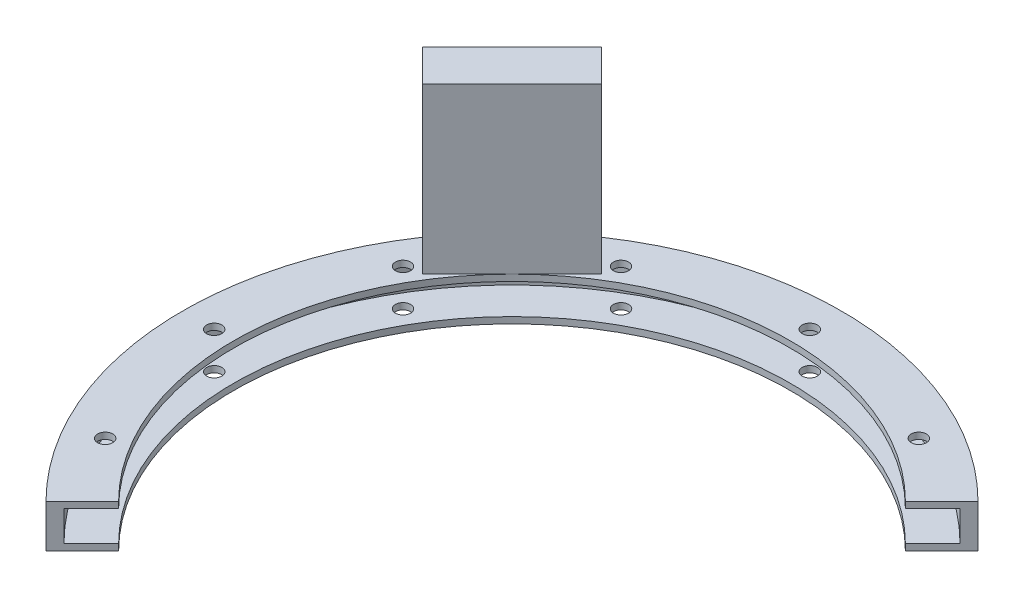
from build123d import *

# Parameters (mm, degrees)
SKETCH1_R           = 260
SKETCH1_R_2         = 6
SKETCH1_R_3         = 219.5
BOSS_EXTRUDE1_DEPTH = 17
SKETCH2_R           = 250
CUT_EXTRUDE1_DEPTH  = 12
CUT_EXTRUDE2_DEPTH  = 370.264133108
BOSS_EXTRUDE2_DEPTH = 130


with BuildPart() as part:
    # Sketch1 → Boss-Extrude1 (new, symmetric)
    with BuildSketch(Plane(origin=(0, 0, 0), x_dir=(1, 0, 0), z_dir=(0, 1, 0))):
        with Locations(Location((0, 0, 0), (0, 0, 270))):
            Circle(SKETCH1_R)
        with Locations(Location((-117.5, 203.515969889, 0), (0, 0, 270))):
            Circle(SKETCH1_R_2, mode=Mode.SUBTRACT)
        with Locations(Location((-203.515969889, 117.5, 0), (0, 0, 270))):
            Circle(SKETCH1_R_2, mode=Mode.SUBTRACT)
        with Locations(Location((-235, 0, 0), (0, 0, 270))):
            Circle(SKETCH1_R_2, mode=Mode.SUBTRACT)
        with Locations(Location((-203.515969889, -117.5, 0), (0, 0, 270))):
            Circle(SKETCH1_R_2, mode=Mode.SUBTRACT)
        with Locations(Location((-117.5, -203.515969889, 0), (0, 0, 270))):
            Circle(SKETCH1_R_2, mode=Mode.SUBTRACT)
        with Locations(Location((0, -235, 0), (0, 0, 270))):
            Circle(SKETCH1_R_2, mode=Mode.SUBTRACT)
        with Locations(Location((117.5, -203.515969889, 0), (0, 0, 270))):
            Circle(SKETCH1_R_2, mode=Mode.SUBTRACT)
        with Locations(Location((203.515969889, -117.5, 0), (0, 0, 270))):
            Circle(SKETCH1_R_2, mode=Mode.SUBTRACT)
        with Locations(Location((235, 0, 0), (0, 0, 270))):
            Circle(SKETCH1_R_2, mode=Mode.SUBTRACT)
        with Locations(Location((203.515969889, 117.5, 0), (0, 0, 270))):
            Circle(SKETCH1_R_2, mode=Mode.SUBTRACT)
        with Locations(Location((117.5, 203.515969889, 0), (0, 0, 270))):
            Circle(SKETCH1_R_2, mode=Mode.SUBTRACT)
        with Locations(Location((0, 235, 0), (0, 0, 270))):
            Circle(SKETCH1_R_2, mode=Mode.SUBTRACT)
        with Locations(Location((0, 0, 0), (0, 0, 270))):
            Circle(SKETCH1_R_3, mode=Mode.SUBTRACT)
    extrude(amount=BOSS_EXTRUDE1_DEPTH, both=True)

    # Sketch2 → Cut-Extrude1 (cut, symmetric)
    with BuildSketch(Plane(origin=(0, 0, 0), x_dir=(1, 0, 0), z_dir=(0, 1, 0))):
        with Locations(Location((0, 0, 0), (0, 0, 270))):
            Circle(SKETCH2_R)
    extrude(amount=CUT_EXTRUDE1_DEPTH, both=True, mode=Mode.SUBTRACT)

    # Sketch3 → Cut-Extrude2 (cut, through all)
    with BuildSketch(Plane(origin=(0, 17, 0), x_dir=(1, 0, 0), z_dir=(0, 1, 0))):
        Polygon((-183.847763109, -183.847763109), (183.847763109, 183.847763109), (370.704407613, -3.008881396), (3.008881396, -370.704407613), align=None)
    extrude(amount=-CUT_EXTRUDE2_DEPTH, mode=Mode.SUBTRACT)

    # Sketch4 → Boss-Extrude2 (add)
    with BuildSketch(Plane(origin=(0, 17, 0), x_dir=(1, 0, 0), z_dir=(0, 1, 0))):
        Polygon((-215.771524586, 145.060846467), (-190.56527753, 119.854599411), (-119.854599411, 190.56527753), (-145.060846467, 215.771524586), align=None)
    extrude(amount=BOSS_EXTRUDE2_DEPTH)


solid = part.part
